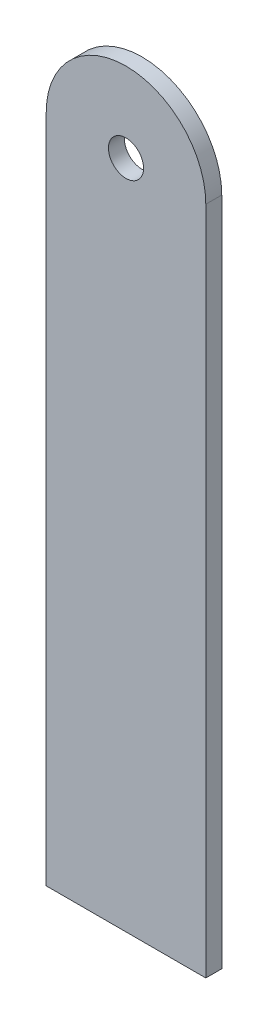
from build123d import *

# Parameters (mm, degrees)
SKETCH1_R           = 5.5
BOSS_EXTRUDE1_DEPTH = 5


with BuildPart() as part:
    # Sketch1 → Boss-Extrude1 (new body)
    with BuildSketch(Plane.XY):
        with BuildLine():
            Line((0, 0), (0, 210))
            ThreePointArc((0, 210), (25, 235), (50, 210))
            Line((50, 210), (50, 0))
            Line((50, 0), (0, 0))
        make_face()
        with Locations((25, 210)):
            Circle(SKETCH1_R, mode=Mode.SUBTRACT)
    extrude(amount=BOSS_EXTRUDE1_DEPTH)


solid = part.part
